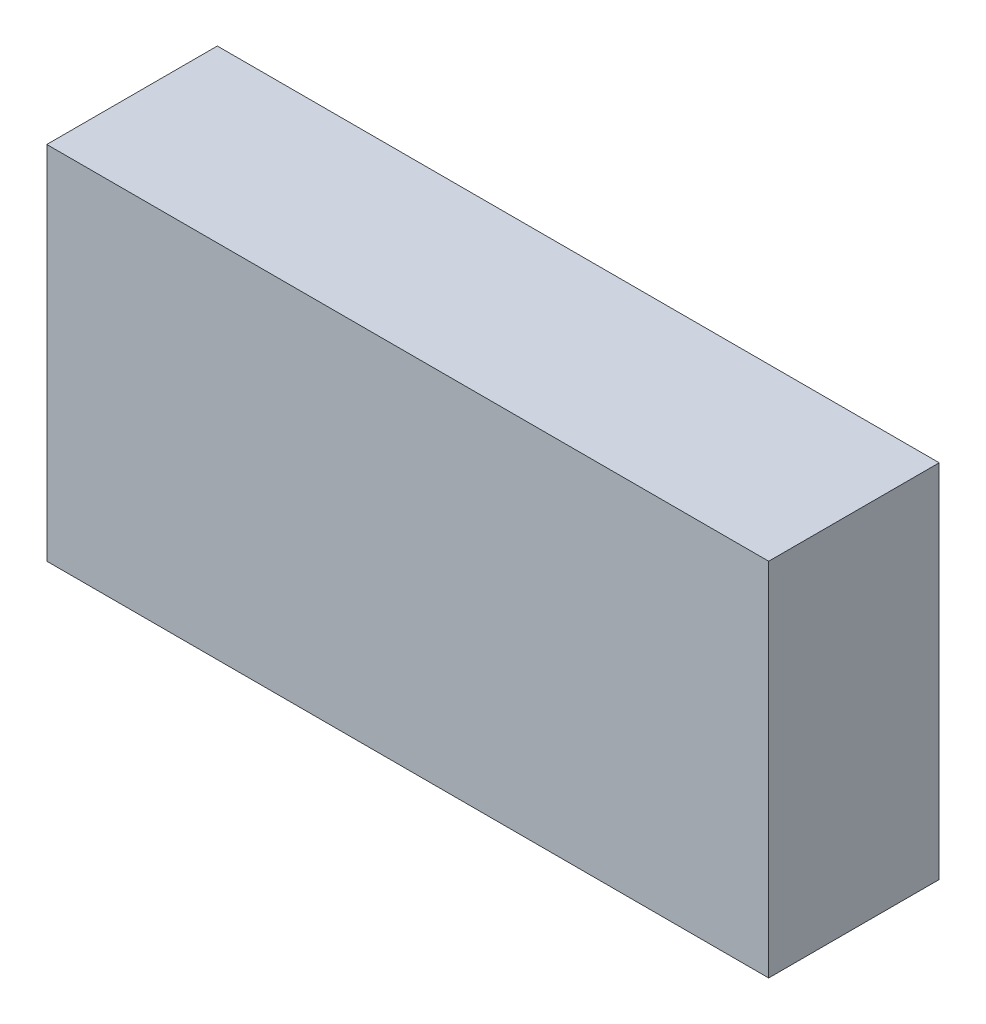
from build123d import *

# Parameters (mm, degrees)
CROQUIS1_W              = 25.4
CROQUIS1_H              = 12.7
SALIENTE_EXTRUIR1_DEPTH = 6


with BuildPart() as part:
    # Croquis1 → Saliente-Extruir1 (new body)
    with BuildSketch(Plane.XY):
        with Locations((12.7, 6.35)):
            Rectangle(CROQUIS1_W, CROQUIS1_H)
    extrude(amount=SALIENTE_EXTRUIR1_DEPTH)


solid = part.part
